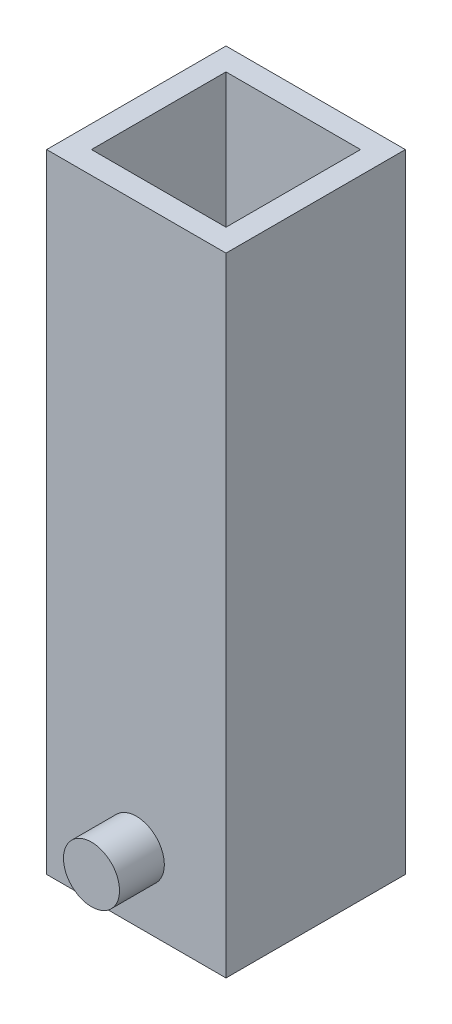
from build123d import *

# Parameters (mm, degrees)
BOSS_EXTRUDE1_DEPTH      = 250
BOSS_EXTRUDE1_DEPTH_BACK = 30
SKETCH1_W                = 80
SKETCH1_H                = 80
SKETCH1_W_2              = 60
SKETCH1_H_2              = 60
SKETCH2_R                = 12.5
BOSS_EXTRUDE2_DEPTH      = 20
BOSS_EXTRUDE3_START      = 25
SKETCH3_R                = 12.5
BOSS_EXTRUDE3_DEPTH      = 25


with BuildPart() as part:
    # Sketch1 → Boss-Extrude1 (new, two sides: drawn at the far end of the back side and taken through both)
    with BuildSketch(Plane(origin=(0, 0, 0), x_dir=(1, 0, 0), z_dir=(0, 1, 0)).offset(-BOSS_EXTRUDE1_DEPTH_BACK)):
        Rectangle(SKETCH1_W, SKETCH1_H)
        Rectangle(SKETCH1_W_2, SKETCH1_H_2, mode=Mode.SUBTRACT)
    extrude(amount=BOSS_EXTRUDE1_DEPTH + BOSS_EXTRUDE1_DEPTH_BACK)

    # Sketch2 → Boss-Extrude2 (add)
    with BuildSketch(Plane.XY.offset(40)):
        Circle(SKETCH2_R)
    extrude(amount=BOSS_EXTRUDE2_DEPTH)

    # Sketch3 → Boss-Extrude3 (add)
    with BuildSketch(Plane(origin=(0, 0, -40), x_dir=(-1, 0, 0), z_dir=(0, 0, -1)).offset(BOSS_EXTRUDE3_START)):
        with Locations(Location((0, 0, 0), (0, 0, 180))):
            Circle(SKETCH3_R)
    extrude(amount=-BOSS_EXTRUDE3_DEPTH)


solid = part.part
